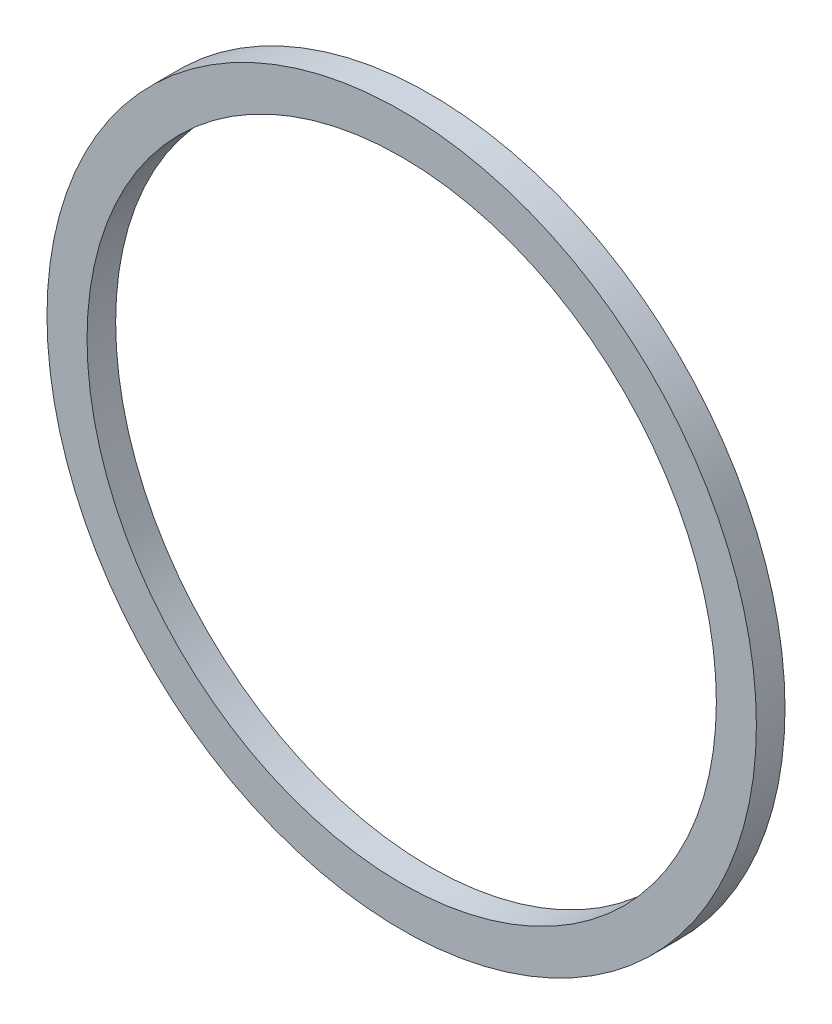
from build123d import *

# Parameters (mm, degrees)
ESQUISSE1_R          = 31
ESQUISSE1_R_2        = 27.5
BASE_EXTRUSION_DEPTH = 2.5


with BuildPart() as part:
    # Esquisse1 → Base-Extrusion (new body)
    with BuildSketch(Plane.XY):
        Circle(ESQUISSE1_R)
        Circle(ESQUISSE1_R_2, mode=Mode.SUBTRACT)
    extrude(amount=BASE_EXTRUSION_DEPTH)


solid = part.part
